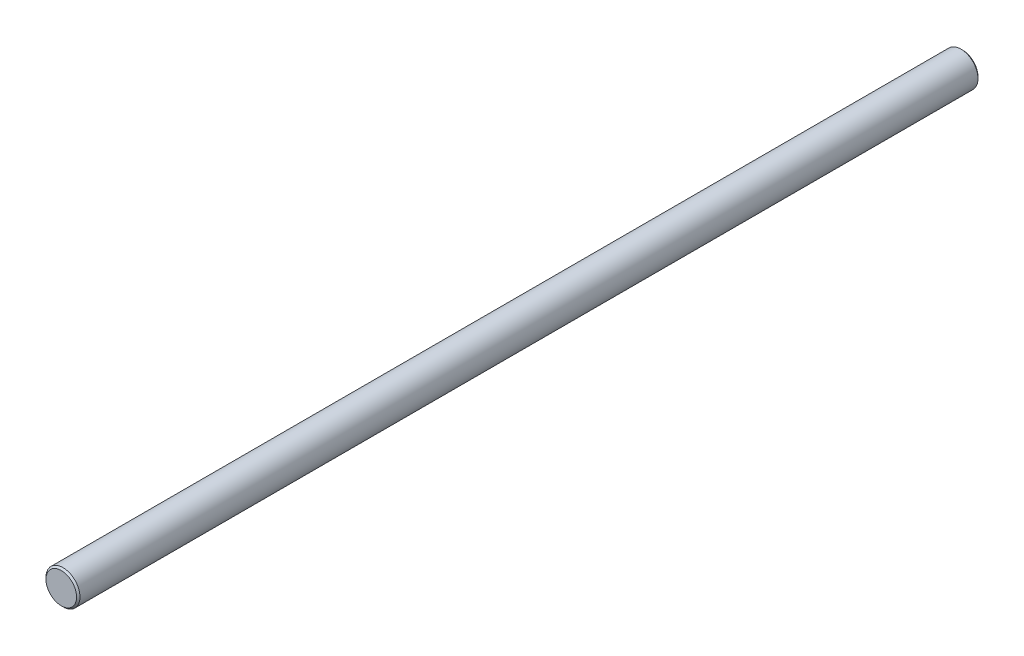
from build123d import *

# Parameters (mm, degrees)
SKETCH1_R           = 1
BOSS_EXTRUDE1_DEPTH = 53
CHAMFER1_SIZE       = 0.1


with BuildPart() as part:
    # Sketch1 → Boss-Extrude1 (new body)
    with BuildSketch(Plane.XY):
        Circle(SKETCH1_R)
    extrude(amount=BOSS_EXTRUDE1_DEPTH)

    # Chamfer1
    chamfer1_edges = [part.edges().sort_by_distance(p)[0] for p in [
        (-1, 0, 0),
        (-1, 0, 53),
    ]]
    chamfer(chamfer1_edges, length=CHAMFER1_SIZE)


solid = part.part
